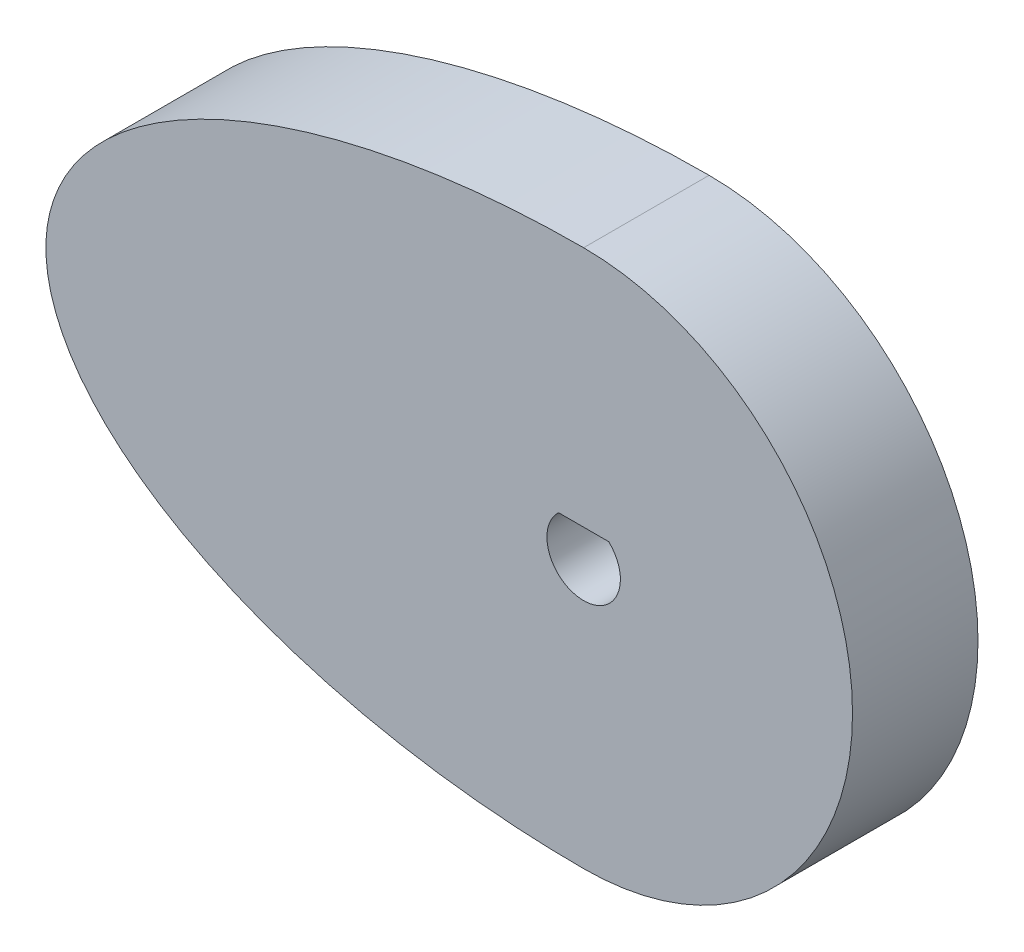
from build123d import *

# Parameters (mm, degrees)
BOSS_EXTRUDE2_DEPTH = 14
CUT_EXTRUDE1_DEPTH  = 14


with BuildPart() as part:
    # Sketch1 → Boss-Extrude2 (new body)
    with BuildSketch(Plane.XY):
        with BuildLine():
            ThreePointArc((0, -30), (30, 0), (0, 30))
            add(Edge.make_bspline(
                [(0, 30), (-60, 30), (-60, 0), (-60, -30), (0, -30)],
                knots=[1.570796327, 1.570796327, 1.570796327, 3.141592654, 3.141592654, 4.71238898, 4.71238898, 4.71238898], degree=2, weights=[1, 0.707106781, 1, 0.707106781, 1]))
        make_face()
    extrude(amount=BOSS_EXTRUDE2_DEPTH)

    # Sketch2 → Cut-Extrude1 (cut)
    with BuildSketch(Plane(origin=(0, 0, 0), x_dir=(-1, 0, 0), z_dir=(0, 0, -1))):
        with BuildLine():
            Line((-2.794637722, 3), (2.794637722, 3))
            ThreePointArc((2.794637722, 3), (0, -4.1), (-2.794637722, 3))
        make_face()
    extrude(amount=-CUT_EXTRUDE1_DEPTH, mode=Mode.SUBTRACT)


solid = part.part
